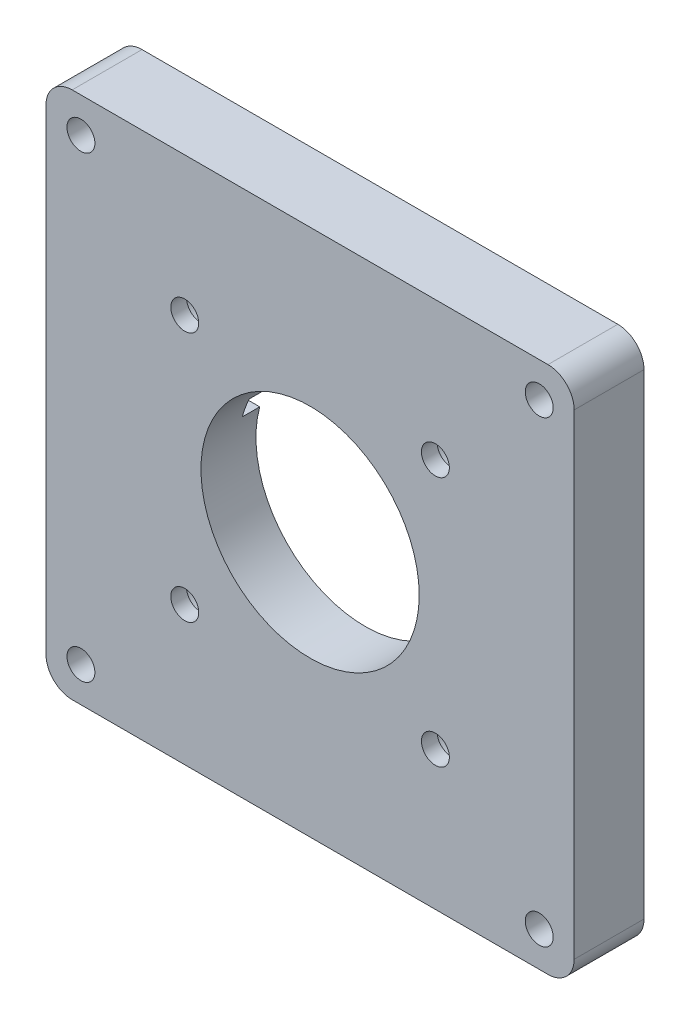
from build123d import *

# Parameters (mm, degrees)
SKETCH_1_W          = 60.5
SKETCH_1_H          = 60.5
SKETCH_1_W_2        = 38.5
SKETCH_1_H_2        = 38.5
EXTRUDE_1_DEPTH     = 8
CUT_EXTRUDE_1_DEPTH = 2.35
SKETCH_3_R          = 1.6
CUT_EXTRUDE_2_DEPTH = 44.521546388
SKETCH_4_W          = 38.5
SKETCH_4_H          = 38.5
SKETCH_4_R          = 12.5
EXTRUDE_2_DEPTH     = 6.8
HOLE_WIZARD_M3_1_D  = 3.2
SKETCH_10_W         = 32
SKETCH_10_H         = 32
CUT_EXTRUDE_4_DEPTH = 0.5
SKETCH_11_W         = 4.5
SKETCH_11_H         = 8
SKETCH_11_W_2       = 5
SKETCH_11_H_2       = 3.75
CUT_EXTRUDE_6_DEPTH = 2
SKETCH_9_R          = 3
CUT_EXTRUDE_7_DEPTH = 5
FILLET_1_R          = 3


with BuildPart() as part:
    # ｽｹｯﾁ1 → ﾎﾞｽ - 押し出し1 (new body)
    with BuildSketch(Plane.XY):
        Rectangle(SKETCH_1_W, SKETCH_1_H)
        Rectangle(SKETCH_1_W_2, SKETCH_1_H_2, mode=Mode.SUBTRACT)
    extrude(amount=EXTRUDE_1_DEPTH)

    # ｽｹｯﾁ2 → ｶｯﾄ - 押し出し1 (cut)
    with BuildSketch(Plane(origin=(0, 0, 0), x_dir=(-1, 0, 0), z_dir=(0, 0, -1))):
        with BuildLine():
            Line((-19.25, 24.95), (19.25, 24.95))
            ThreePointArc((19.25, 24.95), (23.280508653, 23.280508653), (24.95, 19.25))
            Line((24.95, 19.25), (24.95, -19.25))
            ThreePointArc((24.95, -19.25), (23.280508653, -23.280508653), (19.25, -24.95))
            Line((19.25, -24.95), (-19.25, -24.95))
            ThreePointArc((-19.25, -24.95), (-23.280508653, -23.280508653), (-24.95, -19.25))
            Line((-24.95, -19.25), (-24.95, 19.25))
            ThreePointArc((-24.95, 19.25), (-23.280508653, 23.280508653), (-19.25, 24.95))
        make_face()
        with BuildLine():
            Line((-19.25, 20.75), (19.25, 20.75))
            ThreePointArc((19.25, 20.75), (20.310660172, 20.310660172), (20.75, 19.25))
            Line((20.75, 19.25), (20.75, -19.25))
            ThreePointArc((20.75, -19.25), (20.310660172, -20.310660172), (19.25, -20.75))
            Line((19.25, -20.75), (-19.25, -20.75))
            ThreePointArc((-19.25, -20.75), (-20.310660172, -20.310660172), (-20.75, -19.25))
            Line((-20.75, -19.25), (-20.75, 19.25))
            ThreePointArc((-20.75, 19.25), (-20.310660172, 20.310660172), (-19.25, 20.75))
        make_face(mode=Mode.SUBTRACT)
    extrude(amount=-CUT_EXTRUDE_1_DEPTH, mode=Mode.SUBTRACT)

    # ｽｹｯﾁ3 → ｶｯﾄ - 押し出し2 (cut, through all)
    with BuildSketch(Plane(origin=(0, 0, 0), x_dir=(-1, 0, 0), z_dir=(0, 0, -1))):
        with Locations((26.25, 26.25)):
            Circle(SKETCH_3_R)
        with Locations((26.25, -26.25)):
            Circle(SKETCH_3_R)
        with Locations((-26.25, -26.25)):
            Circle(SKETCH_3_R)
        with Locations((-26.25, 26.25)):
            Circle(SKETCH_3_R)
    extrude(amount=-CUT_EXTRUDE_2_DEPTH, mode=Mode.SUBTRACT)

    # ｽｹｯﾁ4 → ﾎﾞｽ - 押し出し2 (add)
    with BuildSketch(Plane.XY.offset(1.2)):
        Rectangle(SKETCH_4_W, SKETCH_4_H)
        Circle(SKETCH_4_R, mode=Mode.SUBTRACT)
    extrude(amount=EXTRUDE_2_DEPTH)

    # M3 すきま穴1 (through all)
    with Locations(Plane(origin=(0, 0, 1.2), x_dir=(-1, 0, 0), z_dir=(0, 0, -1))):
        with Locations((14.354267658, 14.354267658), (-14.354267658, 14.354267658), (-14.354267658, -14.354267658), (14.354267658, -14.354267658)):
            Hole(HOLE_WIZARD_M3_1_D / 2)

    # ｽｹｯﾁ10 → ｶｯﾄ - 押し出し4 (cut)
    with BuildSketch(Plane(origin=(0, 0, 1.2), x_dir=(-1, 0, 0), z_dir=(0, 0, -1))):
        Rectangle(SKETCH_10_W, SKETCH_10_H)
    extrude(amount=-CUT_EXTRUDE_4_DEPTH, mode=Mode.SUBTRACT)

    # ｽｹｯﾁ11 → ｶｯﾄ - 押し出し6 (cut)
    with BuildSketch(Plane(origin=(0, 0, 1.7), x_dir=(-1, 0, 0), z_dir=(0, 0, -1))):
        with Locations((13.5, 7.25)):
            Rectangle(SKETCH_11_W, SKETCH_11_H)
        with Locations((-13.25, -8.875)):
            Rectangle(SKETCH_11_W_2, SKETCH_11_H_2)
    extrude(amount=-CUT_EXTRUDE_6_DEPTH, mode=Mode.SUBTRACT)

    # ｽｹｯﾁ9 → ｶｯﾄ - 押し出し7 (cut)
    with BuildSketch(Plane(origin=(0, 0, 1.2), x_dir=(-1, 0, 0), z_dir=(0, 0, -1))):
        with Locations((14.354267658, 14.354267658)):
            Circle(SKETCH_9_R)
        with Locations((-14.354267658, 14.354267658)):
            Circle(SKETCH_9_R)
        with Locations((14.354267658, -14.354267658)):
            Circle(SKETCH_9_R)
        with Locations((-14.354267658, -14.354267658)):
            Circle(SKETCH_9_R)
    extrude(amount=-CUT_EXTRUDE_7_DEPTH, mode=Mode.SUBTRACT)

    # ﾌｨﾚｯﾄ1
    fillet_1_edges = [part.edges().sort_by_distance(p)[0] for p in [
        (30.25, -30.25, 4),
        (-30.25, -30.25, 4),
        (-30.25, 30.25, 4),
        (30.25, 30.25, 4),
    ]]
    fillet(fillet_1_edges, radius=FILLET_1_R)


solid = part.part
